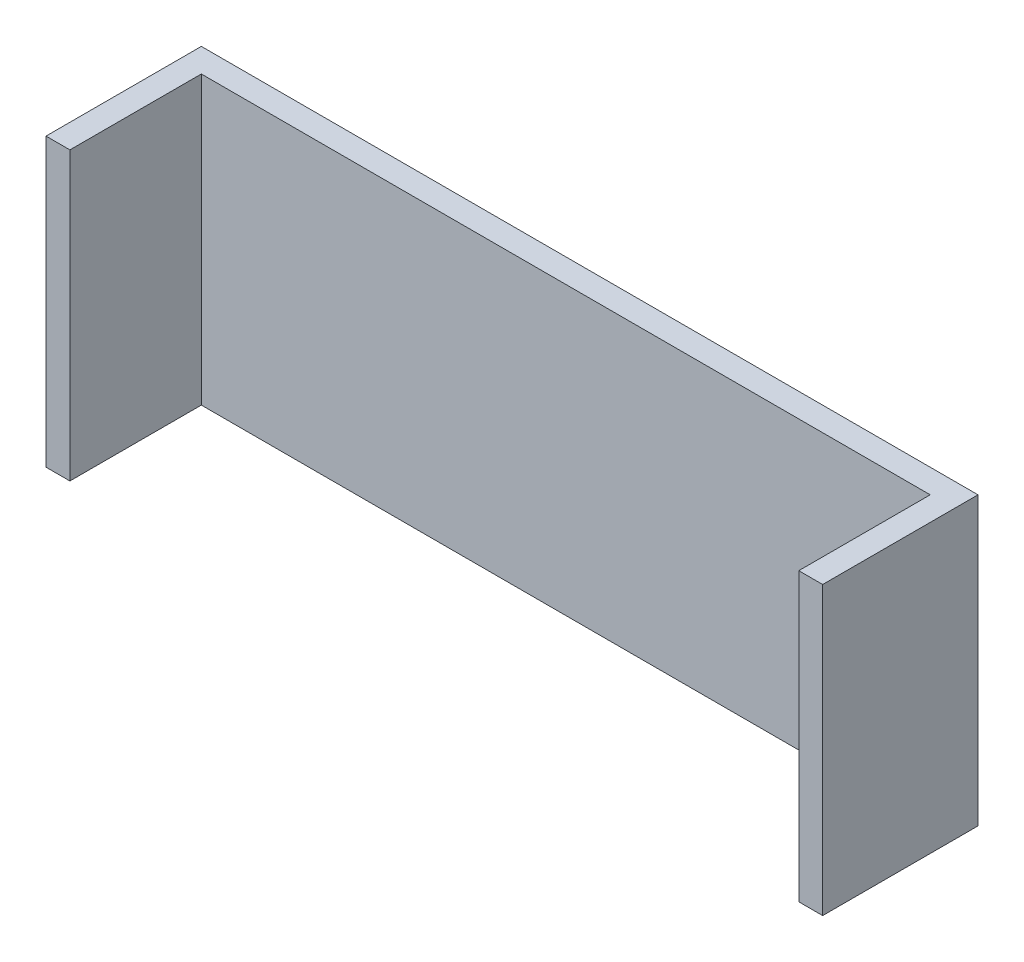
from build123d import *

# Parameters (mm, degrees)
SKETCH_1_W          = 65
SKETCH_1_H          = 24
EXTRUDE_1_DEPTH     = 13
SKETCH_2_W          = 61
SKETCH_2_H          = 24
CUT_EXTRUDE_1_DEPTH = 11


with BuildPart() as part:
    # 草圖1 → 填料-伸長1 (new body)
    with BuildSketch(Plane.XY):
        with Locations((-32.5, 12)):
            Rectangle(SKETCH_1_W, SKETCH_1_H)
    extrude(amount=EXTRUDE_1_DEPTH)

    # 草圖2 → 除料-伸長1 (cut)
    with BuildSketch(Plane.XY.offset(13)):
        with Locations((-32.5, 12)):
            Rectangle(SKETCH_2_W, SKETCH_2_H)
    extrude(amount=-CUT_EXTRUDE_1_DEPTH, mode=Mode.SUBTRACT)


solid = part.part
